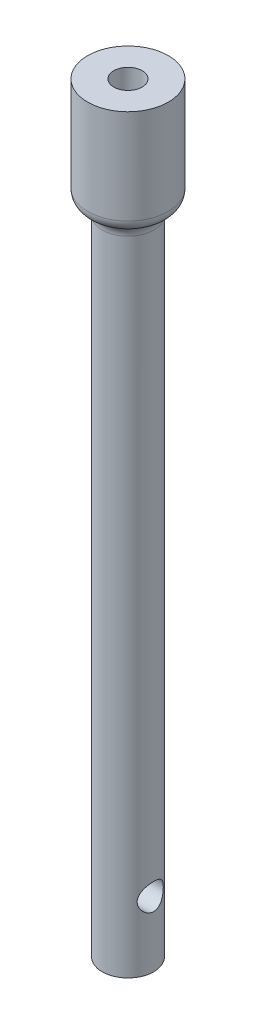
from build123d import *

# Parameters (mm, degrees)
BOSS_EXTRUDE1_DEPTH     = 10
CUT_EXTRUDE1_DEPTH      = 234.65368604
CUT_EXTRUDE1_DEPTH_BACK = 234.65368604
SKETCH3_R               = 4
FILLET1_R               = 4
FILLET2_R               = 4


with BuildPart() as part:
    # Sketch1 → Revolve1 (revolve)
    with BuildSketch(Plane.XY):
        Polygon((0, 0), (-7.9, 0), (-7.9, 200), (-12.35, 200), (-12.35, 233), (-4.35, 233), (-4.35, 220), (0, 220), align=None)
    revolve(axis=Axis((0, 220, 0), (0, -1, 0)))

    # Sketch2 → Boss-Extrude1 (add)
    with BuildSketch(Plane(origin=(0, 220, 0), x_dir=(1, 0, 0), z_dir=(0, 1, 0))):
        with BuildLine():
            ThreePointArc((4.35, 0), (3.817394399, 2.085665361), (2.35, 3.660601044))
            Line((2.35, 3.660601044), (2.35, -3.660601044))
            ThreePointArc((2.35, -3.660601044), (3.817394399, -2.085665361), (4.35, 0))
        make_face()
    extrude(amount=BOSS_EXTRUDE1_DEPTH)

    # Sketch3 → Cut-Extrude1 (cut, two sides: drawn at the far end of the back side and taken through both)
    with BuildSketch(Plane(origin=(0, 0, 0), x_dir=(0, 0, -1), z_dir=(1, 0, 0)).offset(-CUT_EXTRUDE1_DEPTH_BACK)):
        with Locations((0, 20)):
            Circle(SKETCH3_R)
    extrude(amount=CUT_EXTRUDE1_DEPTH + CUT_EXTRUDE1_DEPTH_BACK, mode=Mode.SUBTRACT)

    # Fillet1
    fillet1_edges = [part.edges().sort_by_distance(p)[0] for p in [
        (12.35, 200, 0),
    ]]
    fillet(fillet1_edges, radius=FILLET1_R)

    # Fillet2
    fillet2_edges = [part.edges().sort_by_distance(p)[0] for p in [
        (7.9, 200, 0),
    ]]
    fillet(fillet2_edges, radius=FILLET2_R)


solid = part.part
